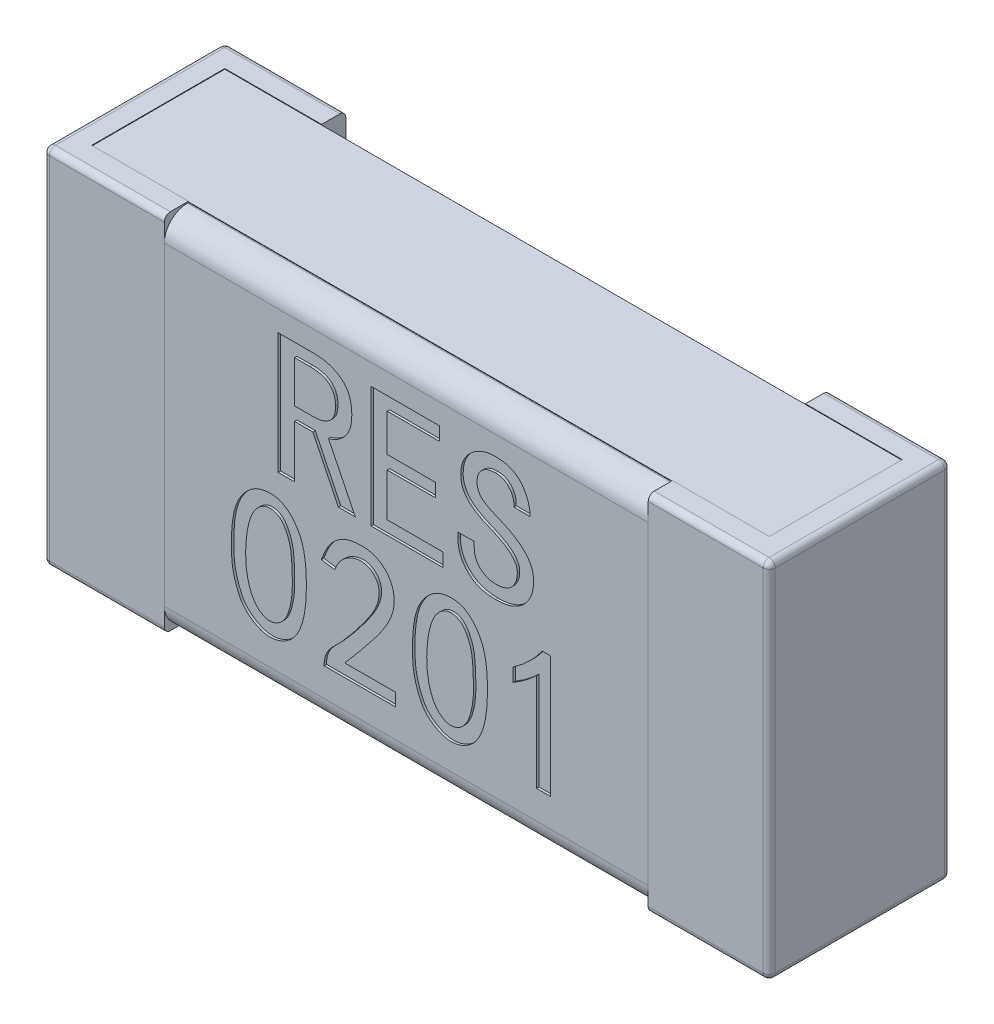
from build123d import *

# Parameters (mm, degrees)
BOSS_EXTRUDE1_START   = 0.02
SKETCH1_W             = 0.56
SKETCH1_H             = 0.299
BOSS_EXTRUDE1_DEPTH   = 0.11
SKETCH2_W             = 0.1
SKETCH2_H             = 0.3
BOSS_EXTRUDE2_DEPTH   = 0.02
BOSS_EXTRUDE2_2_DEPTH = 0.02
BOSS_EXTRUDE3_START   = 0.13
SKETCH2_2_W           = 0.1
SKETCH2_2_H           = 0.3
BOSS_EXTRUDE3_DEPTH   = 0.02
BOSS_EXTRUDE4_START   = 0.02
SKETCH3_W             = 0.02
SKETCH3_H             = 0.3
BOSS_EXTRUDE4_DEPTH   = 0.11
BOSS_EXTRUDE5_START   = 0.13
SKETCH4_W             = 0.4
SKETCH4_H             = 0.298
BOSS_EXTRUDE5_DEPTH   = 0.02
FILLET1_R             = 0.019
FILLET2_R             = 0.019
FILLET3_R             = 0.005
FILLET6_R             = 0.005
FILLET4_R             = 0.005
FILLET5_R             = 0.005
FILLET7_R             = 0.005
FILLET9_R             = 0.005
FILLET8_R             = 0.005
FILLET10_R            = 0.005
CUT_EXTRUDE1_DEPTH    = 0.002


with BuildPart() as part:
    # Sketch1 → Boss-Extrude1 (new body)
    with BuildSketch(Plane.XY.offset(BOSS_EXTRUDE1_START)):
        Rectangle(SKETCH1_W, SKETCH1_H)
    extrude(amount=BOSS_EXTRUDE1_DEPTH)

    # Sketch2<2> → Boss-Extrude3 (add)
    with BuildSketch(Plane.XY.offset(BOSS_EXTRUDE3_START)):
        with Locations((0.25, 0)):
            Rectangle(SKETCH2_2_W, SKETCH2_2_H)
        with Locations((-0.25, 0)):
            Rectangle(SKETCH2_2_W, SKETCH2_2_H)
    extrude(amount=BOSS_EXTRUDE3_DEPTH)



with BuildPart() as body_2:
    # Sketch2 → Boss-Extrude2 (new body)
    with BuildSketch(Plane.XY):
        with Locations((0.25, 0)):
            Rectangle(SKETCH2_W, SKETCH2_H)
    extrude(amount=BOSS_EXTRUDE2_DEPTH)


with BuildPart() as body_3:
    # Sketch2 → Boss-Extrude2 2 (new body)
    with BuildSketch(Plane.XY):
        with Locations((-0.25, 0)):
            Rectangle(SKETCH2_W, SKETCH2_H)
    extrude(amount=BOSS_EXTRUDE2_2_DEPTH)


with BuildPart() as part_1:
    add(part.part)

    add(body_2.part)  # Boss-Extrude4 merges body 2

    add(body_3.part)  # Boss-Extrude4 merges body 3
    # Sketch3 → Boss-Extrude4 (add)
    with BuildSketch(Plane.XY.offset(BOSS_EXTRUDE4_START)):
        with Locations((0.29, 0)):
            Rectangle(SKETCH3_W, SKETCH3_H)
        with Locations((-0.29, 0)):
            Rectangle(SKETCH3_W, SKETCH3_H)
    extrude(amount=BOSS_EXTRUDE4_DEPTH)

    # Fillet3
    fillet3_edges = [part_1.edges().sort_by_distance(p)[0] for p in [
        (-0.3, 0, 0.15),
    ]]
    fillet(fillet3_edges, radius=FILLET3_R)

    # Fillet6
    fillet6_edges = [part_1.edges().sort_by_distance(p)[0] for p in [
        (-0.3, 0, 0),
    ]]
    fillet(fillet6_edges, radius=FILLET6_R)

    # Fillet4
    fillet4_edges = [part_1.edges().sort_by_distance(p)[0] for p in [
        (-0.3, -0.15, 0.075),
        (-0.2475, -0.15, 0),
        (-0.2475, -0.15, 0.15),
    ]]
    fillet(fillet4_edges, radius=FILLET4_R)

    # Fillet5
    fillet5_edges = [part_1.edges().sort_by_distance(p)[0] for p in [
        (-0.3, 0.15, 0.075),
        (-0.2475, 0.15, 0),
        (-0.2475, 0.15, 0.15),
    ]]
    fillet(fillet5_edges, radius=FILLET5_R)

    # Fillet7
    fillet7_edges = [part_1.edges().sort_by_distance(p)[0] for p in [
        (0.3, 0, 0),
    ]]
    fillet(fillet7_edges, radius=FILLET7_R)

    # Fillet9
    fillet9_edges = [part_1.edges().sort_by_distance(p)[0] for p in [
        (0.3, 0, 0.15),
    ]]
    fillet(fillet9_edges, radius=FILLET9_R)

    # Fillet8
    fillet8_edges = [part_1.edges().sort_by_distance(p)[0] for p in [
        (0.3, -0.15, 0.075),
        (0.2475, -0.15, 0.15),
        (0.2475, -0.15, 0),
    ]]
    fillet(fillet8_edges, radius=FILLET8_R)

    # Fillet10
    fillet10_edges = [part_1.edges().sort_by_distance(p)[0] for p in [
        (0.3, 0.15, 0.075),
        (0.2475, 0.15, 0.15),
        (0.2475, 0.15, 0),
    ]]
    fillet(fillet10_edges, radius=FILLET10_R)


with BuildPart() as body_2_2:
    # Sketch4 → Boss-Extrude5 (new body)
    with BuildSketch(Plane.XY.offset(BOSS_EXTRUDE5_START)):
        Rectangle(SKETCH4_W, SKETCH4_H)
    extrude(amount=BOSS_EXTRUDE5_DEPTH)

    # Fillet1
    fillet1_edges = [body_2_2.edges().sort_by_distance(p)[0] for p in [
        (0, 0.149, 0.15),
    ]]
    fillet(fillet1_edges, radius=FILLET1_R)

    # Fillet2
    fillet2_edges = [body_2_2.edges().sort_by_distance(p)[0] for p in [
        (0, -0.149, 0.15),
    ]]
    fillet(fillet2_edges, radius=FILLET2_R)

    # Sketch6 → Cut-Extrude1 (cut)
    # profile 1 of 7: a face of its own
    with BuildSketch(Plane.XY.offset(0.15)):
        with BuildLine():
            add(Edge.make_bspline(
                [(-0.144444444, -0.050654104), (-0.144388757, -0.049397291), (-0.144280142, -0.046945986), (-0.143966333, -0.043371707), (-0.143587377, -0.039988953), (-0.143094684, -0.036808069), (-0.142485739, -0.033839643), (-0.14179649, -0.031068118), (-0.140999953, -0.028501249), (-0.139827069, -0.02536635), (-0.138068274, -0.021758119), (-0.135552509, -0.017792414), (-0.132629108, -0.014227525), (-0.129863477, -0.011615414), (-0.127465488, -0.009776998), (-0.12554954, -0.008583374), (-0.123536656, -0.007563512), (-0.121420235, -0.006731793), (-0.119204168, -0.006112243), (-0.116894326, -0.005654835), (-0.114483086, -0.005371876), (-0.111998422, -0.005287692), (-0.109495036, -0.005405565), (-0.107035817, -0.005789561), (-0.104662715, -0.006471253), (-0.102374107, -0.007407107), (-0.100176223, -0.008609564), (-0.098057999, -0.010068965), (-0.096044546, -0.011823052), (-0.094110772, -0.0138006), (-0.09230457, -0.015977049), (-0.090650093, -0.018310395), (-0.089154214, -0.02077657), (-0.087836871, -0.023389104), (-0.08665603, -0.026124959), (-0.085665409, -0.029008504), (-0.084845841, -0.032028026), (-0.083943369, -0.036293629), (-0.083149389, -0.041951842), (-0.082590019, -0.049112976), (-0.08246238, -0.056748751), (-0.082652437, -0.063352132), (-0.0830107, -0.068702395), (-0.083418005, -0.072583007), (-0.083965086, -0.076265861), (-0.084601953, -0.079768883), (-0.085398713, -0.083073443), (-0.086342882, -0.086183084), (-0.087363014, -0.089118119), (-0.088563765, -0.091847696), (-0.089871571, -0.094394996), (-0.091362581, -0.09672739), (-0.092977883, -0.098876382), (-0.094760296, -0.100824942), (-0.096733041, -0.102533818), (-0.098827485, -0.10408547), (-0.101099875, -0.1054061), (-0.103489659, -0.106526784), (-0.105950956, -0.107418705), (-0.108453038, -0.108000033), (-0.110948706, -0.108345551), (-0.113455545, -0.108346815), (-0.115958704, -0.108128856), (-0.118447901, -0.107555505), (-0.120953842, -0.106767209), (-0.123409404, -0.105652409), (-0.125772823, -0.104368773), (-0.127997431, -0.102987194), (-0.130022432, -0.101483839), (-0.131864006, -0.09987838), (-0.133545125, -0.098184295), (-0.13504595, -0.096385504), (-0.136350904, -0.094477025), (-0.137809166, -0.091791094), (-0.13937143, -0.088326569), (-0.140988365, -0.084059106), (-0.142309892, -0.079688995), (-0.14315966, -0.075933532), (-0.143719911, -0.0727918), (-0.144028162, -0.070216362), (-0.144295925, -0.067444004), (-0.144457753, -0.064474081), (-0.144565396, -0.061304017), (-0.144612244, -0.057931553), (-0.144562101, -0.054357084), (-0.144484356, -0.051910223), (-0.144444444, -0.050654104)],
                knots=[0, 0, 0, 0, 1.18043416, 2.302333746, 3.366253517, 4.374302266, 5.321670991, 6.208995316, 7.053297808, 7.84229274, 9.348259463, 10.810477328, 12.240076564, 13.663562249, 14.3695339, 15.072606272, 15.778577923, 16.484387009, 17.202829605, 17.934942377, 18.692112664, 19.478485278, 20.265441384, 21.040673806, 21.808439453, 22.577161074, 23.356320991, 24.155029842, 24.986154494, 25.858111265, 26.748121484, 27.637306138, 28.540117759, 29.452135788, 30.380885827, 31.334339875, 32.310628684, 33.31521083, 35.42407972, 37.666773946, 40.052062172, 42.587025658, 43.863776122, 45.083322308, 46.247467896, 47.357025429, 48.423487632, 49.435172604, 50.405897663, 51.337337341, 52.231284254, 53.090220275, 53.931690991, 54.751583713, 55.562922169, 56.377338113, 57.194202079, 58.024663732, 58.851830165, 59.645552351, 60.431282623, 61.21044254, 61.99312915, 62.783838437, 63.60230231, 64.454612977, 65.309477934, 66.125301685, 66.909862715, 67.67340185, 68.415973016, 69.147238889, 69.868837108, 70.581506411, 72.0124375, 73.431838244, 74.861437481, 76.292961888, 77.042577341, 77.855187732, 78.726196438, 79.655959089, 80.645695907, 81.702690171, 82.820655125, 84, 84, 84, 84], degree=3))
        make_face()
        with BuildLine():
            add(Edge.make_bspline(
                [(-0.132163743, -0.047145332), (-0.13229651, -0.04846569), (-0.132558066, -0.051066841), (-0.132771987, -0.054925598), (-0.132832949, -0.058675122), (-0.132777124, -0.062316929), (-0.132561839, -0.065843893), (-0.132194526, -0.06926284), (-0.1316713, -0.07257137), (-0.131030917, -0.07576071), (-0.13026365, -0.078779883), (-0.129353733, -0.081587871), (-0.128318028, -0.084164217), (-0.127172296, -0.086512802), (-0.125914631, -0.08863643), (-0.124521616, -0.090523042), (-0.123032333, -0.092212772), (-0.121402274, -0.09363279), (-0.119730411, -0.094825299), (-0.118021117, -0.095751867), (-0.116302271, -0.096408434), (-0.11456731, -0.096809887), (-0.11282249, -0.096938069), (-0.111067113, -0.096813907), (-0.109314166, -0.096380547), (-0.107572354, -0.095716363), (-0.105891652, -0.094801573), (-0.104301649, -0.093696959), (-0.102835496, -0.092377814), (-0.10149242, -0.090858296), (-0.1002801, -0.089129008), (-0.099170849, -0.087219511), (-0.098196842, -0.085098136), (-0.097051494, -0.081992065), (-0.095898019, -0.07785561), (-0.094871804, -0.072686756), (-0.094266517, -0.067296315), (-0.094107817, -0.061765724), (-0.094211003, -0.056270399), (-0.094334762, -0.050946949), (-0.094632346, -0.045885325), (-0.094988495, -0.041059751), (-0.095592912, -0.036448684), (-0.096706773, -0.032076274), (-0.098266965, -0.027930665), (-0.099868333, -0.02465813), (-0.101403039, -0.022282637), (-0.102612884, -0.02068875), (-0.103957923, -0.019356866), (-0.105376188, -0.018221427), (-0.106900672, -0.017356994), (-0.108517589, -0.016710378), (-0.110226231, -0.016309664), (-0.112000705, -0.01611208), (-0.113788427, -0.01614662), (-0.115544402, -0.016460399), (-0.117247519, -0.017009155), (-0.118908496, -0.017790375), (-0.120492483, -0.018847735), (-0.1220248, -0.020141845), (-0.123488183, -0.021694496), (-0.12492971, -0.02346355), (-0.126244634, -0.025517767), (-0.127460706, -0.027818876), (-0.128539135, -0.030396443), (-0.12950498, -0.03323555), (-0.130372402, -0.036336042), (-0.13110173, -0.039699784), (-0.131706942, -0.043329459), (-0.132008005, -0.045844381), (-0.132163743, -0.047145332)],
                knots=[0, 0, 0, 0, 1.378198314, 2.715098627, 4.012594964, 5.272602849, 6.497213731, 7.681415101, 8.842769074, 9.975170128, 11.059162755, 12.076494648, 13.038717388, 13.940857576, 14.788360499, 15.598271168, 16.373595835, 17.122768248, 17.838466736, 18.502782022, 19.136468245, 19.744060339, 20.345653328, 20.947246317, 21.563841626, 22.214212994, 22.87852828, 23.546305104, 24.220743313, 24.921956094, 25.648106704, 26.41081768, 27.212668989, 28.069279432, 29.84713992, 31.666334073, 33.537864714, 35.473745168, 37.408579624, 39.246547954, 41.003985019, 42.674193204, 44.272363647, 45.827394737, 47.348405091, 48.867584295, 49.599750274, 50.283750763, 50.94125936, 51.560811542, 52.165388272, 52.754418158, 53.363720025, 53.982318455, 54.604903792, 55.213928724, 55.828148287, 56.458765578, 57.113918044, 57.800421407, 58.537638978, 59.326979919, 60.167286366, 61.066273245, 62.027297208, 63.065989643, 64.179487018, 65.369443928, 66.639232213, 68, 68, 68, 68], degree=3))
        make_face(mode=Mode.SUBTRACT)
    # profile 2 of 7: a face of its own
    with BuildSketch(Plane.XY.offset(0.15)):
        with BuildLine():
            add(Edge.make_bspline(
                [(0.005263158, -0.050654104), (0.005318846, -0.049397291), (0.00542746, -0.046945986), (0.005741269, -0.043371707), (0.006120225, -0.039988953), (0.006612919, -0.036808069), (0.007221863, -0.033839643), (0.007911113, -0.031068118), (0.00870765, -0.028501249), (0.009880534, -0.02536635), (0.011639329, -0.021758119), (0.014155093, -0.017792414), (0.017078495, -0.014227525), (0.019844125, -0.011615414), (0.022242114, -0.009776998), (0.024158062, -0.008583374), (0.026170946, -0.007563512), (0.028287368, -0.006731793), (0.030503435, -0.006112243), (0.032813277, -0.005654835), (0.035224516, -0.005371876), (0.03770918, -0.005287692), (0.040212566, -0.005405565), (0.042671785, -0.005789561), (0.045044888, -0.006471253), (0.047333495, -0.007407107), (0.04953138, -0.008609564), (0.051649604, -0.010068965), (0.053663056, -0.011823052), (0.05559683, -0.0138006), (0.057403032, -0.015977049), (0.059057509, -0.018310395), (0.060553388, -0.02077657), (0.061870731, -0.023389104), (0.063051572, -0.026124959), (0.064042193, -0.029008504), (0.064861761, -0.032028026), (0.065764234, -0.036293629), (0.066558214, -0.041951842), (0.067117583, -0.049112976), (0.067245222, -0.056748751), (0.067055165, -0.063352132), (0.066696902, -0.068702395), (0.066289598, -0.072583007), (0.065742516, -0.076265861), (0.065105649, -0.079768883), (0.064308889, -0.083073443), (0.06336472, -0.086183084), (0.062344588, -0.089118119), (0.061143837, -0.091847696), (0.059836032, -0.094394996), (0.058345021, -0.09672739), (0.056729719, -0.098876382), (0.054947307, -0.100824942), (0.052974561, -0.102533818), (0.050880117, -0.10408547), (0.048607727, -0.1054061), (0.046217944, -0.106526784), (0.043756647, -0.107418705), (0.041254564, -0.108000033), (0.038758897, -0.108345551), (0.036252057, -0.108346815), (0.033748899, -0.108128856), (0.031259701, -0.107555505), (0.02875376, -0.106767209), (0.026298199, -0.105652409), (0.023934779, -0.104368773), (0.021710171, -0.102987194), (0.01968517, -0.101483839), (0.017843597, -0.09987838), (0.016162477, -0.098184295), (0.014661652, -0.096385504), (0.013356698, -0.094477025), (0.011898436, -0.091791094), (0.010336172, -0.088326569), (0.008719237, -0.084059106), (0.007397711, -0.079688995), (0.006547942, -0.075933532), (0.005987691, -0.0727918), (0.00567944, -0.070216362), (0.005411677, -0.067444004), (0.005249849, -0.064474081), (0.005142207, -0.061304017), (0.005095359, -0.057931553), (0.005145501, -0.054357084), (0.005223247, -0.051910223), (0.005263158, -0.050654104)],
                knots=[0, 0, 0, 0, 1.18043416, 2.302333746, 3.366253517, 4.374302266, 5.321670991, 6.208995316, 7.053297808, 7.84229274, 9.348259463, 10.810477328, 12.240076564, 13.663562249, 14.3695339, 15.072606272, 15.778577923, 16.484387009, 17.202829605, 17.934942377, 18.692112664, 19.478485278, 20.265441384, 21.040673806, 21.808439453, 22.577161074, 23.356320991, 24.155029842, 24.986154494, 25.858111265, 26.748121484, 27.637306138, 28.540117759, 29.452135788, 30.380885827, 31.334339875, 32.310628684, 33.31521083, 35.42407972, 37.666773946, 40.052062172, 42.587025658, 43.863776122, 45.083322308, 46.247467896, 47.357025429, 48.423487632, 49.435172604, 50.405897663, 51.337337341, 52.231284254, 53.090220275, 53.931690991, 54.751583713, 55.562922169, 56.377338113, 57.194202079, 58.024663732, 58.851830165, 59.645552351, 60.431282623, 61.21044254, 61.99312915, 62.783838437, 63.60230231, 64.454612977, 65.309477934, 66.125301685, 66.909862715, 67.67340185, 68.415973016, 69.147238889, 69.868837108, 70.581506411, 72.0124375, 73.431838244, 74.861437481, 76.292961888, 77.042577341, 77.855187732, 78.726196438, 79.655959089, 80.645695907, 81.702690171, 82.820655125, 84, 84, 84, 84], degree=3))
        make_face()
        with BuildLine():
            add(Edge.make_bspline(
                [(0.01754386, -0.047145332), (0.017411093, -0.04846569), (0.017149537, -0.051066841), (0.016935616, -0.054925598), (0.016874654, -0.058675122), (0.016930478, -0.062316929), (0.017145763, -0.065843893), (0.017513076, -0.06926284), (0.018036303, -0.07257137), (0.018676686, -0.07576071), (0.019443953, -0.078779883), (0.02035387, -0.081587871), (0.021389574, -0.084164217), (0.022535307, -0.086512802), (0.023792971, -0.08863643), (0.025185986, -0.090523042), (0.026675269, -0.092212772), (0.028305329, -0.09363279), (0.029977191, -0.094825299), (0.031686485, -0.095751867), (0.033405332, -0.096408434), (0.035140292, -0.096809887), (0.036885113, -0.096938069), (0.038640489, -0.096813907), (0.040393436, -0.096380547), (0.042135248, -0.095716363), (0.04381595, -0.094801573), (0.045405954, -0.093696959), (0.046872106, -0.092377814), (0.048215182, -0.090858296), (0.049427502, -0.089129008), (0.050536753, -0.087219511), (0.05151076, -0.085098136), (0.052656108, -0.081992065), (0.053809583, -0.07785561), (0.054835799, -0.072686756), (0.055441086, -0.067296315), (0.055599786, -0.061765724), (0.055496599, -0.056270399), (0.05537284, -0.050946949), (0.055075256, -0.045885325), (0.054719108, -0.041059751), (0.05411469, -0.036448684), (0.053000829, -0.032076274), (0.051440637, -0.027930665), (0.049839269, -0.02465813), (0.048304563, -0.022282637), (0.047094718, -0.02068875), (0.045749679, -0.019356866), (0.044331414, -0.018221427), (0.04280693, -0.017356994), (0.041190014, -0.016710378), (0.039481372, -0.016309664), (0.037706897, -0.01611208), (0.035919175, -0.01614662), (0.034163201, -0.016460399), (0.032460083, -0.017009155), (0.030799107, -0.017790375), (0.029215119, -0.018847735), (0.027682803, -0.020141845), (0.026219419, -0.021694496), (0.024777892, -0.02346355), (0.023462969, -0.025517767), (0.022246897, -0.027818876), (0.021168467, -0.030396443), (0.020202622, -0.03323555), (0.0193352, -0.036336042), (0.018605873, -0.039699784), (0.01800066, -0.043329459), (0.017699597, -0.045844381), (0.01754386, -0.047145332)],
                knots=[0, 0, 0, 0, 1.378198314, 2.715098627, 4.012594964, 5.272602849, 6.497213731, 7.681415101, 8.842769074, 9.975170128, 11.059162755, 12.076494648, 13.038717388, 13.940857576, 14.788360499, 15.598271168, 16.373595835, 17.122768248, 17.838466736, 18.502782022, 19.136468245, 19.744060339, 20.345653328, 20.947246317, 21.563841626, 22.214212994, 22.87852828, 23.546305104, 24.220743313, 24.921956094, 25.648106704, 26.41081768, 27.212668989, 28.069279432, 29.84713992, 31.666334073, 33.537864714, 35.473745168, 37.408579624, 39.246547954, 41.003985019, 42.674193204, 44.272363647, 45.827394737, 47.348405091, 48.867584295, 49.599750274, 50.283750763, 50.94125936, 51.560811542, 52.165388272, 52.754418158, 53.363720025, 53.982318455, 54.604903792, 55.213928724, 55.828148287, 56.458765578, 57.113918044, 57.800421407, 58.537638978, 59.326979919, 60.167286366, 61.066273245, 62.027297208, 63.065989643, 64.179487018, 65.369443928, 66.639232213, 68, 68, 68, 68], degree=3))
        make_face(mode=Mode.SUBTRACT)
    # profile 3 of 7: a face of its own
    with BuildSketch(Plane.XY.offset(0.15)):
        with BuildLine():
            Line((-0.042105263, 0.012923977), (-0.056140351, 0.012923977))
            Line((-0.056140351, 0.012923977), (-0.077192982, 0.05619883))
            Line((-0.077192982, 0.05619883), (-0.092397661, 0.05619883))
            Line((-0.092397661, 0.05619883), (-0.092397661, 0.012923977))
            Line((-0.092397661, 0.012923977), (-0.105847953, 0.012923977))
            Line((-0.105847953, 0.012923977), (-0.105847953, 0.112923977))
            Line((-0.105847953, 0.112923977), (-0.076608187, 0.112923977))
            add(Edge.make_bspline(
                [(-0.076608187, 0.112923977), (-0.075466941, 0.112901338), (-0.073230881, 0.112856981), (-0.069955814, 0.112564171), (-0.066852347, 0.112015922), (-0.063914165, 0.111276552), (-0.061125454, 0.110362397), (-0.05852087, 0.10917264), (-0.05606027, 0.107814782), (-0.053774826, 0.106234802), (-0.051706217, 0.104419785), (-0.04989518, 0.102328058), (-0.048389291, 0.099957024), (-0.047136631, 0.097326478), (-0.046202852, 0.094430862), (-0.045501825, 0.091278572), (-0.045094845, 0.087860668), (-0.045051547, 0.085490222), (-0.04502924, 0.084269006)],
                knots=[0, 0, 0, 0, 1.124851401, 2.203938021, 3.236923468, 4.227547377, 5.188384515, 6.124748074, 7.04535131, 7.955333121, 8.85768773, 9.750678987, 10.67246398, 11.61778816, 12.61462837, 13.664292026, 14.796680505, 16, 16, 16, 16], degree=3))
            add(Edge.make_bspline(
                [(-0.04502924, 0.084269006), (-0.045043021, 0.083322437), (-0.045069914, 0.081475389), (-0.045361146, 0.078790089), (-0.045808826, 0.076268913), (-0.04643514, 0.073909893), (-0.047252366, 0.071713404), (-0.048283769, 0.069688792), (-0.049468852, 0.06781421), (-0.051286431, 0.065593038), (-0.053796829, 0.063188957), (-0.057074345, 0.060809365), (-0.060588429, 0.059005962), (-0.063085444, 0.058302918), (-0.064327485, 0.057953216)],
                knots=[0, 0, 0, 0, 0.960252019, 1.873748618, 2.737466876, 3.556786617, 4.347431233, 5.110891588, 5.858830743, 6.593445102, 8.018399741, 9.372640647, 10.693124067, 12, 12, 12, 12], degree=3))
            Line((-0.064327485, 0.057953216), (-0.042105263, 0.012923977))
        make_face()
        with BuildLine():
            add(Edge.make_bspline(
                [(-0.058479532, 0.084269006), (-0.058499574, 0.084933616), (-0.058538675, 0.086230258), (-0.058744111, 0.088126125), (-0.05914319, 0.089907043), (-0.059668148, 0.091587542), (-0.060410539, 0.093130637), (-0.06123462, 0.094600145), (-0.062281811, 0.095923165), (-0.063443492, 0.097171222), (-0.064796813, 0.098278962), (-0.066334984, 0.099247752), (-0.068073477, 0.100037675), (-0.069999065, 0.100684611), (-0.072105969, 0.101206029), (-0.074410302, 0.101565247), (-0.076907121, 0.101783987), (-0.078636443, 0.101803012), (-0.079532164, 0.101812865)],
                knots=[0, 0, 0, 0, 1.018423225, 1.986923476, 2.915383729, 3.810714658, 4.676600435, 5.533969095, 6.385612358, 7.253966558, 8.141821118, 9.056210967, 10.031005151, 11.059229177, 12.164336364, 13.351610032, 14.628236891, 16, 16, 16, 16], degree=3))
            Line((-0.079532164, 0.101812865), (-0.092397661, 0.101812865))
            Line((-0.092397661, 0.101812865), (-0.092397661, 0.067309942))
            Line((-0.092397661, 0.067309942), (-0.076023392, 0.067309942))
            add(Edge.make_bspline(
                [(-0.076023392, 0.067309942), (-0.074885856, 0.067353039), (-0.072659401, 0.067437393), (-0.069443867, 0.068177492), (-0.066441504, 0.069360133), (-0.064141091, 0.070738474), (-0.062476486, 0.072106088), (-0.061409585, 0.073344393), (-0.060489008, 0.074737629), (-0.059758415, 0.076319346), (-0.059169145, 0.078060219), (-0.058764818, 0.079979293), (-0.058530426, 0.082068363), (-0.058496911, 0.08351753), (-0.058479532, 0.084269006)],
                knots=[0, 0, 0, 0, 1.47184772, 2.880791526, 4.249240139, 5.638178403, 6.335067569, 7.030952029, 7.746845966, 8.491482783, 9.28109559, 10.123026367, 11.02668324, 12, 12, 12, 12], degree=3))
        make_face(mode=Mode.SUBTRACT)
    # profile 4 of 7: a face of its own
    with BuildSketch(Plane.XY.offset(0.15)):
        Polygon((0.030409357, 0.012923977), (-0.029239766, 0.012923977), (-0.029239766, 0.112923977), (0.02748538, 0.112923977), (0.02748538, 0.101812865), (-0.015789474, 0.101812865), (-0.015789474, 0.070818713), (0.023976608, 0.070818713), (0.023976608, 0.059707602), (-0.015789474, 0.059707602), (-0.015789474, 0.024035088), (0.030409357, 0.024035088), align=None)
    # profile 5 of 7: a face of its own
    with BuildSketch(Plane.XY.offset(0.15)):
        with BuildLine():
            add(Edge.make_bspline(
                [(0.105263158, 0.040994152), (0.105239108, 0.039902828), (0.10519212, 0.037770664), (0.104798045, 0.034650564), (0.104131421, 0.03170474), (0.103196079, 0.028931244), (0.102000385, 0.026337363), (0.100535669, 0.023909359), (0.098802348, 0.021653893), (0.096803722, 0.019599218), (0.094591216, 0.017752537), (0.092171515, 0.01614421), (0.089562544, 0.014769426), (0.086746822, 0.013670818), (0.083754257, 0.0128002), (0.08056219, 0.012202895), (0.077187427, 0.011829538), (0.074869246, 0.011779808), (0.073684211, 0.011754386)],
                knots=[0, 0, 0, 0, 1.076144108, 2.102505996, 3.095825232, 4.050645424, 4.984196986, 5.907479825, 6.841845839, 7.783590996, 8.729097989, 9.679099523, 10.644246964, 11.632062862, 12.655232941, 13.713869879, 14.831347993, 16, 16, 16, 16], degree=3))
            add(Edge.make_bspline(
                [(0.073684211, 0.011754386), (0.07249892, 0.011777385), (0.070186611, 0.011822253), (0.066827332, 0.012226983), (0.063652472, 0.012837855), (0.060690783, 0.013755905), (0.057914146, 0.014893224), (0.055366633, 0.016328655), (0.052976729, 0.017960649), (0.050859084, 0.019908416), (0.048915955, 0.021988262), (0.047280439, 0.024263573), (0.045848958, 0.0266288), (0.044706799, 0.02914139), (0.043777882, 0.031766806), (0.043169635, 0.034539723), (0.042758968, 0.037429788), (0.042713302, 0.039404328), (0.042690058, 0.040409357)],
                knots=[0, 0, 0, 0, 1.196538468, 2.33425201, 3.412396666, 4.457161548, 5.460527637, 6.436390177, 7.405227411, 8.375846278, 9.335670364, 10.274835003, 11.200142775, 12.12337999, 13.057237208, 14.007039654, 14.985594985, 16, 16, 16, 16], degree=3))
            Line((0.042690058, 0.040409357), (0.042690058, 0.044502924))
            Line((0.042690058, 0.044502924), (0.056140351, 0.044502924))
            Line((0.056140351, 0.044502924), (0.056140351, 0.040994152))
            add(Edge.make_bspline(
                [(0.056140351, 0.040994152), (0.056158453, 0.04028604), (0.056193838, 0.038901822), (0.056425774, 0.036891485), (0.056840023, 0.03500468), (0.057420922, 0.033254996), (0.05816448, 0.031624968), (0.059077806, 0.030131065), (0.060143525, 0.028748186), (0.061782546, 0.027128376), (0.064070641, 0.025453684), (0.067058672, 0.023929359), (0.070306212, 0.023043568), (0.072545501, 0.022925524), (0.073684211, 0.022865497)],
                knots=[0, 0, 0, 0, 0.899937149, 1.759196843, 2.567308812, 3.350717544, 4.097934817, 4.839099816, 5.571408796, 6.31103876, 7.760779786, 9.155922253, 10.553747428, 12, 12, 12, 12], degree=3))
            add(Edge.make_bspline(
                [(0.073684211, 0.022865497), (0.074435407, 0.022885639), (0.075897612, 0.022924845), (0.078016524, 0.023126115), (0.079979838, 0.023521939), (0.081782569, 0.024055251), (0.083436115, 0.02475414), (0.084921787, 0.025620007), (0.086275316, 0.026622798), (0.087808775, 0.028190286), (0.089424829, 0.03037306), (0.090800261, 0.033305286), (0.091659465, 0.036484158), (0.09176089, 0.03869275), (0.091812865, 0.039824561)],
                knots=[0, 0, 0, 0, 0.962219836, 1.872961855, 2.721515218, 3.522926727, 4.276799653, 5.014164922, 5.72050659, 6.426545665, 7.815246758, 9.175842648, 10.55273742, 12, 12, 12, 12], degree=3))
            add(Edge.make_bspline(
                [(0.091812865, 0.039824561), (0.091794942, 0.040309266), (0.091759413, 0.041270043), (0.091510942, 0.042702351), (0.09110412, 0.044107638), (0.090509898, 0.045475665), (0.089759943, 0.046815979), (0.088853596, 0.048128366), (0.087779856, 0.049417442), (0.08608507, 0.051130391), (0.083551758, 0.053194373), (0.08002847, 0.055531354), (0.075909344, 0.057738511), (0.072915124, 0.059030248), (0.071345029, 0.059707602)],
                knots=[0, 0, 0, 0, 0.578251208, 1.146206319, 1.729632852, 2.320140678, 2.921792905, 3.559846951, 4.220588567, 4.921185791, 6.432399352, 8.109791427, 9.960070942, 12, 12, 12, 12], degree=3))
            add(Edge.make_bspline(
                [(0.071345029, 0.059707602), (0.070215833, 0.060148032), (0.068023187, 0.061003246), (0.064876905, 0.062367728), (0.061972388, 0.063764556), (0.059327741, 0.065224832), (0.056913355, 0.066684519), (0.054757117, 0.068205712), (0.052851807, 0.069767195), (0.051154957, 0.071345643), (0.049723912, 0.073020528), (0.048443704, 0.074722927), (0.047413531, 0.07654012), (0.046536028, 0.078403116), (0.045856123, 0.080347803), (0.045393675, 0.082368244), (0.045064326, 0.084460446), (0.045041056, 0.085884891), (0.04502924, 0.086608187)],
                knots=[0, 0, 0, 0, 1.442788407, 2.80157118, 4.081608732, 5.277882525, 6.396683758, 7.438774622, 8.41600694, 9.327939604, 10.193066353, 11.035393571, 11.859457263, 12.674643564, 13.484648255, 14.306018334, 15.139839872, 16, 16, 16, 16], degree=3))
            add(Edge.make_bspline(
                [(0.04502924, 0.086608187), (0.045053844, 0.087605689), (0.045102177, 0.089565246), (0.045492942, 0.092434609), (0.046167774, 0.095155276), (0.047099875, 0.097728078), (0.048303946, 0.100151288), (0.049759268, 0.102434253), (0.051481995, 0.104575972), (0.053469863, 0.106522478), (0.055630143, 0.108287417), (0.057899206, 0.109861764), (0.060294955, 0.111160072), (0.062783782, 0.112225146), (0.065358831, 0.113083429), (0.06804824, 0.113651434), (0.070827911, 0.11404644), (0.072722549, 0.1140777), (0.073684211, 0.114093567)],
                knots=[0, 0, 0, 0, 1.07870255, 2.119071136, 3.124805643, 4.105581286, 5.072990272, 6.045680189, 7.028691787, 8.039235481, 9.049145311, 10.043383937, 11.021887354, 11.990902522, 12.968844852, 13.952259623, 14.960628413, 16, 16, 16, 16], degree=3))
            add(Edge.make_bspline(
                [(0.073684211, 0.114093567), (0.074905277, 0.114061618), (0.077275172, 0.113999609), (0.080696188, 0.113605104), (0.083851031, 0.11288041), (0.086744423, 0.111898947), (0.089373721, 0.11060198), (0.091752658, 0.109054223), (0.09383635, 0.107175049), (0.095642614, 0.105050966), (0.097190266, 0.102764719), (0.098572031, 0.100431495), (0.099750396, 0.098056665), (0.10067723, 0.095613388), (0.101415775, 0.093137764), (0.101972689, 0.090614423), (0.102268854, 0.088037624), (0.10231572, 0.086305621), (0.102339181, 0.085438596)],
                knots=[0, 0, 0, 0, 1.282260702, 2.488662931, 3.608602347, 4.675455947, 5.689164954, 6.679473553, 7.645844993, 8.624331637, 9.600024491, 10.541331786, 11.470286479, 12.379766298, 13.281599694, 14.181168015, 15.089509718, 16, 16, 16, 16], degree=3))
            Line((0.102339181, 0.085438596), (0.088888889, 0.085438596))
            add(Edge.make_bspline(
                [(0.088888889, 0.085438596), (0.088931127, 0.086487564), (0.089014612, 0.088560887), (0.088399594, 0.091622278), (0.087194824, 0.094517568), (0.085746081, 0.096750275), (0.084333872, 0.098383138), (0.083126555, 0.099451822), (0.081828399, 0.100364966), (0.080411367, 0.101118366), (0.078881852, 0.101694048), (0.077240232, 0.102109182), (0.075496006, 0.102345159), (0.07429859, 0.102379858), (0.073684211, 0.102397661)],
                knots=[0, 0, 0, 0, 1.460207937, 2.886156602, 4.313065059, 5.813047609, 6.57660706, 7.318406664, 8.055956018, 8.78576476, 9.550717507, 10.329856714, 11.143068759, 12, 12, 12, 12], degree=3))
            add(Edge.make_bspline(
                [(0.073684211, 0.102397661), (0.072567889, 0.102357606), (0.070439695, 0.102281245), (0.067427953, 0.101548974), (0.064772113, 0.100356698), (0.062522639, 0.098666655), (0.060693267, 0.096597005), (0.059386375, 0.09414393), (0.058618229, 0.091353768), (0.058526964, 0.089385515), (0.058479532, 0.088362573)],
                knots=[0, 0, 0, 0, 1.145558682, 2.183931547, 3.163371772, 4.117557764, 5.053569339, 5.979736134, 6.950027789, 8, 8, 8, 8], degree=3))
            add(Edge.make_bspline(
                [(0.058479532, 0.088362573), (0.058512911, 0.087513869), (0.0585783, 0.085851227), (0.059214709, 0.083454182), (0.060217911, 0.081234871), (0.061410497, 0.079516752), (0.062704253, 0.078234238), (0.064001104, 0.077217688), (0.065614598, 0.076163313), (0.067548282, 0.075061935), (0.06980736, 0.073930126), (0.072359008, 0.072704017), (0.075253827, 0.071483637), (0.077292832, 0.070663955), (0.078362573, 0.070233918)],
                knots=[0, 0, 0, 0, 1.054277047, 2.065368358, 3.062471884, 4.074520743, 4.646282749, 5.323992781, 6.121378042, 7.042966294, 8.091677809, 9.265162139, 10.56519814, 12, 12, 12, 12], degree=3))
            add(Edge.make_bspline(
                [(0.078362573, 0.070233918), (0.079405729, 0.069794349), (0.081451819, 0.06893216), (0.084405594, 0.06752539), (0.087165929, 0.066029854), (0.089755606, 0.064498449), (0.092145792, 0.062888362), (0.0943601, 0.061220386), (0.096400163, 0.059492787), (0.098248577, 0.057692816), (0.099891862, 0.055832691), (0.101349483, 0.053924647), (0.102531252, 0.051912204), (0.10354286, 0.049864684), (0.104299768, 0.047731143), (0.104870288, 0.045552891), (0.105202189, 0.04329298), (0.105242642, 0.041767723), (0.105263158, 0.040994152)],
                knots=[0, 0, 0, 0, 1.286245445, 2.522894961, 3.715884829, 4.852742623, 5.94040206, 6.988895921, 8.001566966, 8.976237793, 9.917821146, 10.82027623, 11.699651049, 12.565605398, 13.411626584, 14.267259483, 15.121199423, 16, 16, 16, 16], degree=3))
        make_face()
    # profile 6 of 7: a face of its own
    with BuildSketch(Plane.XY.offset(0.15)):
        with BuildLine():
            add(Edge.make_bspline(
                [(-0.067836257, -0.104152047), (-0.067765516, -0.103427678), (-0.067624913, -0.101987958), (-0.0671312, -0.099869943), (-0.06643651, -0.097802009), (-0.065522565, -0.095785083), (-0.064394078, -0.093818349), (-0.06300601, -0.091943446), (-0.061455988, -0.090077738), (-0.059602297, -0.088314322), (-0.057603605, -0.086438044), (-0.055533391, -0.08429041), (-0.053291061, -0.081945714), (-0.050967472, -0.079304035), (-0.048464518, -0.076460367), (-0.045878475, -0.07333069), (-0.043147578, -0.069974865), (-0.040348464, -0.066455283), (-0.037605429, -0.062920295), (-0.035077646, -0.059494365), (-0.032778832, -0.056295493), (-0.030727538, -0.053312387), (-0.028978423, -0.050510679), (-0.027459485, -0.047933847), (-0.026163429, -0.045586551), (-0.02487009, -0.042783098), (-0.023649436, -0.03954998), (-0.022692312, -0.035877063), (-0.022257381, -0.032477828), (-0.022428362, -0.029354159), (-0.023099793, -0.02650359), (-0.024272897, -0.023917458), (-0.025919171, -0.021586576), (-0.028023934, -0.019598083), (-0.030423109, -0.017960962), (-0.033092969, -0.016860989), (-0.035949694, -0.01630509), (-0.038938356, -0.016355384), (-0.041950817, -0.016890963), (-0.044951872, -0.017821894), (-0.047844919, -0.019263326), (-0.050679173, -0.021061566), (-0.053305137, -0.023378243), (-0.055613214, -0.026231136), (-0.057576656, -0.029605711), (-0.058556222, -0.032098693), (-0.059064327, -0.033391813)],
                knots=[0, 0, 0, 0, 0.683264685, 1.358023177, 2.0380809, 2.730345762, 3.435487858, 4.164189287, 4.919895072, 5.711413948, 6.565494804, 7.49616148, 8.513531843, 9.613812574, 10.80147361, 12.073102873, 13.428218159, 14.866997124, 16.298560904, 17.632315587, 18.867297526, 20.000038836, 21.033387935, 21.969994494, 22.810824564, 23.551397478, 24.869445784, 26.052467085, 27.111050094, 28.075902372, 28.975949733, 29.847314516, 30.728213316, 31.639844513, 32.554273251, 33.442456201, 34.333871785, 35.270085163, 36.233696473, 37.201335111, 38.211692251, 39.261697588, 40.347896805, 41.485826765, 42.695887429, 44, 44, 44, 44], degree=3))
            Line((-0.059064327, -0.033391813), (-0.070175439, -0.031637427))
            add(Edge.make_bspline(
                [(-0.070175439, -0.031637427), (-0.069783149, -0.030549765), (-0.069019923, -0.028433646), (-0.067705674, -0.025420397), (-0.066348025, -0.022615453), (-0.064909709, -0.0200374), (-0.063359524, -0.01770464), (-0.061735069, -0.015594495), (-0.060029105, -0.013707247), (-0.058235074, -0.012045103), (-0.056359137, -0.010579842), (-0.054388411, -0.009309121), (-0.052347434, -0.008199112), (-0.050228179, -0.007257063), (-0.048026069, -0.006497865), (-0.045731312, -0.005945766), (-0.04336738, -0.005517448), (-0.04175318, -0.005387466), (-0.040935673, -0.005321637)],
                knots=[0, 0, 0, 0, 1.318688324, 2.565594597, 3.747971738, 4.872722892, 5.930337296, 6.940181326, 7.908044283, 8.828858542, 9.726735078, 10.619953387, 11.500744836, 12.374616489, 13.262770363, 14.15366946, 15.064931369, 16, 16, 16, 16], degree=3))
            add(Edge.make_bspline(
                [(-0.040935673, -0.005321637), (-0.039983349, -0.005245258), (-0.038131265, -0.005096714), (-0.035416677, -0.005068745), (-0.032854851, -0.005245924), (-0.030400458, -0.005582418), (-0.028002643, -0.006177261), (-0.025599639, -0.007054997), (-0.023168719, -0.008241355), (-0.020713836, -0.009696436), (-0.018307476, -0.011477665), (-0.016128891, -0.013717463), (-0.014206381, -0.016372466), (-0.012488666, -0.01937592), (-0.011102192, -0.022752709), (-0.010268367, -0.026513942), (-0.009962604, -0.030593986), (-0.010130612, -0.034192857), (-0.01053987, -0.037238182), (-0.011113284, -0.039672061), (-0.011939671, -0.042205734), (-0.012912651, -0.044878444), (-0.014204662, -0.047626809), (-0.015658913, -0.050509827), (-0.017397968, -0.053475227), (-0.018976147, -0.056037185), (-0.020405995, -0.058170306), (-0.021603618, -0.059910949), (-0.022911954, -0.061769004), (-0.024380452, -0.063714929), (-0.025931372, -0.065793341), (-0.027599656, -0.067986287), (-0.029399827, -0.070274755), (-0.031311061, -0.072687749), (-0.033341988, -0.075218834), (-0.035501773, -0.077853343), (-0.037789821, -0.08058535), (-0.040170526, -0.083451878), (-0.042672877, -0.086428899), (-0.045298792, -0.089513608), (-0.048056941, -0.092692107), (-0.049924841, -0.094859741), (-0.050877193, -0.095964912)],
                knots=[0, 0, 0, 0, 0.924262298, 1.797511285, 2.623724224, 3.407158757, 4.191620419, 5.009283641, 5.877881841, 6.805175164, 7.767818098, 8.765683208, 9.814991193, 10.931884262, 12.107176208, 13.332417047, 14.642951659, 16.055476784, 16.810263112, 17.613474593, 18.470705512, 19.388078144, 20.363412498, 21.406914204, 22.511682051, 23.688322701, 24.318011351, 24.996206783, 25.732766533, 26.516574724, 27.354866926, 28.242087009, 29.182574856, 30.172115786, 31.220563025, 32.322544456, 33.468316952, 34.668650042, 35.928027342, 37.231299145, 38.588373428, 40, 40, 40, 40], degree=3))
            Line((-0.050877193, -0.095964912), (-0.00877193, -0.095964912))
            Line((-0.00877193, -0.095964912), (-0.00877193, -0.106491228))
            Line((-0.00877193, -0.106491228), (-0.067836257, -0.106491228))
            Line((-0.067836257, -0.106491228), (-0.067836257, -0.104152047))
        make_face()
    # profile 7 of 7: a face of its own
    with BuildSketch(Plane.XY.offset(0.15)):
        with BuildLine():
            add(Edge.make_bspline(
                [(0.107602339, -0.025789474), (0.106270949, -0.027066818), (0.103527209, -0.02969918), (0.098912193, -0.033356817), (0.093825554, -0.036984533), (0.090180209, -0.039245649), (0.088304094, -0.040409357)],
                knots=[0, 0, 0, 0, 0.911926792, 1.879305458, 2.908561558, 4, 4, 4, 4], degree=3))
            Line((0.088304094, -0.040409357), (0.088304094, -0.029298246))
            add(Edge.make_bspline(
                [(0.088304094, -0.029298246), (0.089504843, -0.028466407), (0.091889556, -0.026814359), (0.095273594, -0.024127316), (0.098545292, -0.02139133), (0.101605715, -0.018494652), (0.104552186, -0.015536028), (0.107287108, -0.012432548), (0.109891656, -0.009243787), (0.111483676, -0.00701983), (0.112280702, -0.005906433)],
                knots=[0, 0, 0, 0, 1.040526584, 2.066506081, 3.077559129, 4.07840537, 5.067830316, 6.05167646, 7.024595449, 8, 8, 8, 8], degree=3))
            Line((0.112280702, -0.005906433), (0.119298246, -0.005906433))
            Line((0.119298246, -0.005906433), (0.119298246, -0.106491228))
            Line((0.119298246, -0.106491228), (0.107602339, -0.106491228))
            Line((0.107602339, -0.106491228), (0.107602339, -0.025789474))
        make_face()
    extrude(amount=-CUT_EXTRUDE1_DEPTH, mode=Mode.SUBTRACT)


solid = Compound([part_1.part, body_2_2.part])
